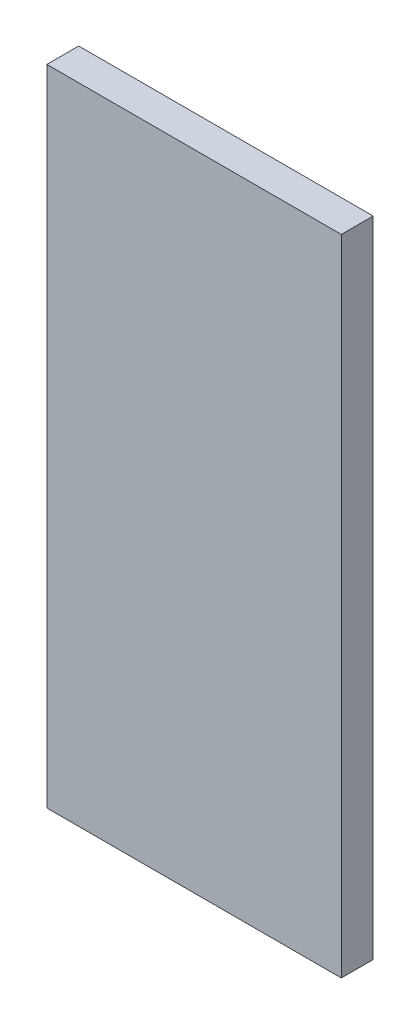
from build123d import *

# Parameters (mm, degrees)
SKETCH1_W      = 10.16
SKETCH1_H      = 22.22
EXTRUDE1_DEPTH = 1.1


with BuildPart() as part:
    # Sketch1 → Extrude1 (new body)
    with BuildSketch(Plane.XY):
        with Locations((-23.18, 2.76)):
            Rectangle(SKETCH1_W, SKETCH1_H)
    extrude(amount=EXTRUDE1_DEPTH)


solid = part.part
